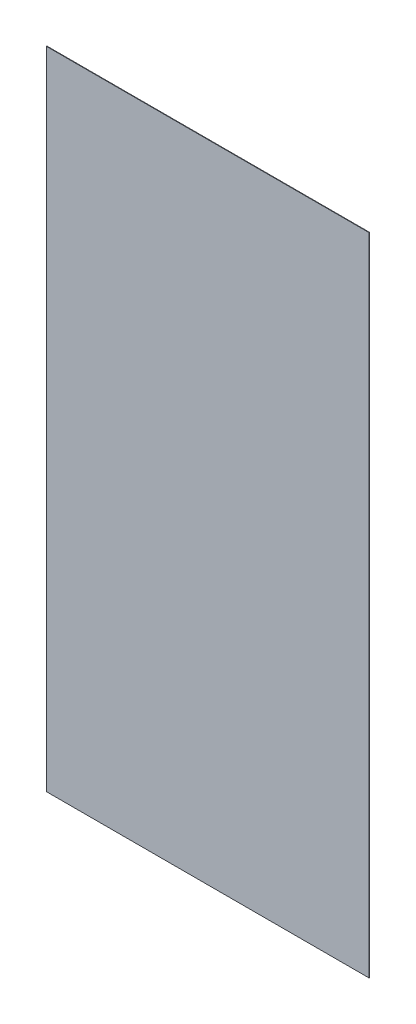
from build123d import *

# Parameters (mm, degrees)
CROQUIS1_W              = 1220
CROQUIS1_H              = 2440
SALIENTE_EXTRUIR1_DEPTH = 1.9


with BuildPart() as part:
    # Croquis1 → Saliente-Extruir1 (new body)
    with BuildSketch(Plane.XY):
        with Locations((610, -1220)):
            Rectangle(CROQUIS1_W, CROQUIS1_H)
    extrude(amount=SALIENTE_EXTRUIR1_DEPTH)


solid = part.part
